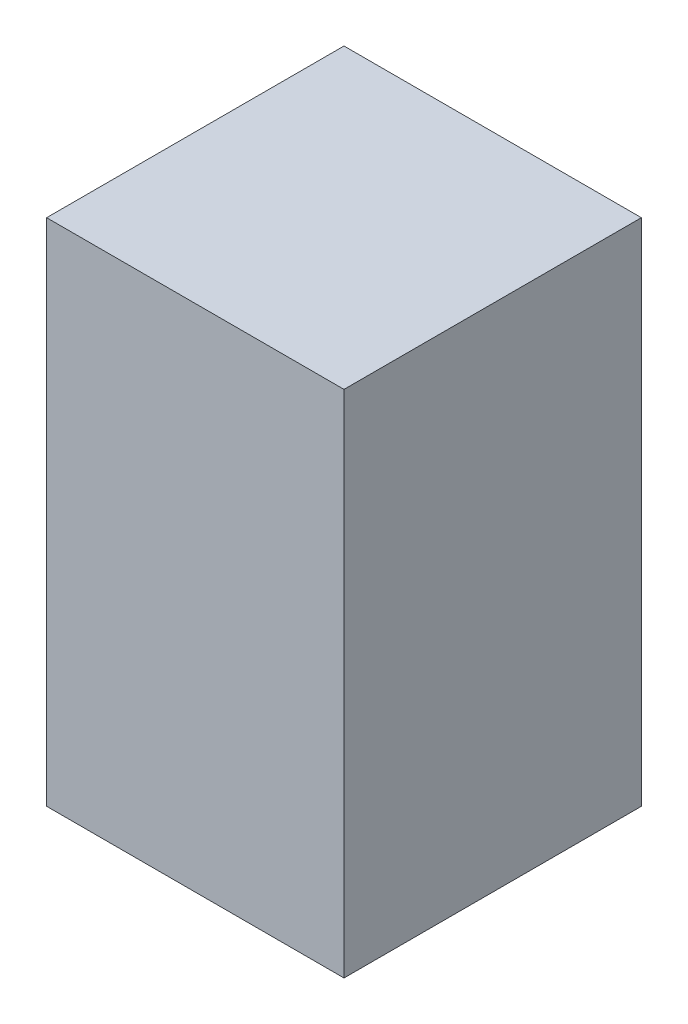
from build123d import *

# Parameters (mm, degrees)
CROQUIS1_W              = 700
CROQUIS1_H              = 700
SALIENTE_EXTRUIR1_DEPTH = 1200


with BuildPart() as part:
    # Croquis1 → Saliente-Extruir1 (new body)
    with BuildSketch(Plane(origin=(0, 0, 0), x_dir=(1, 0, 0), z_dir=(0, 1, 0))):
        Rectangle(CROQUIS1_W, CROQUIS1_H)
    extrude(amount=SALIENTE_EXTRUIR1_DEPTH)


solid = part.part
